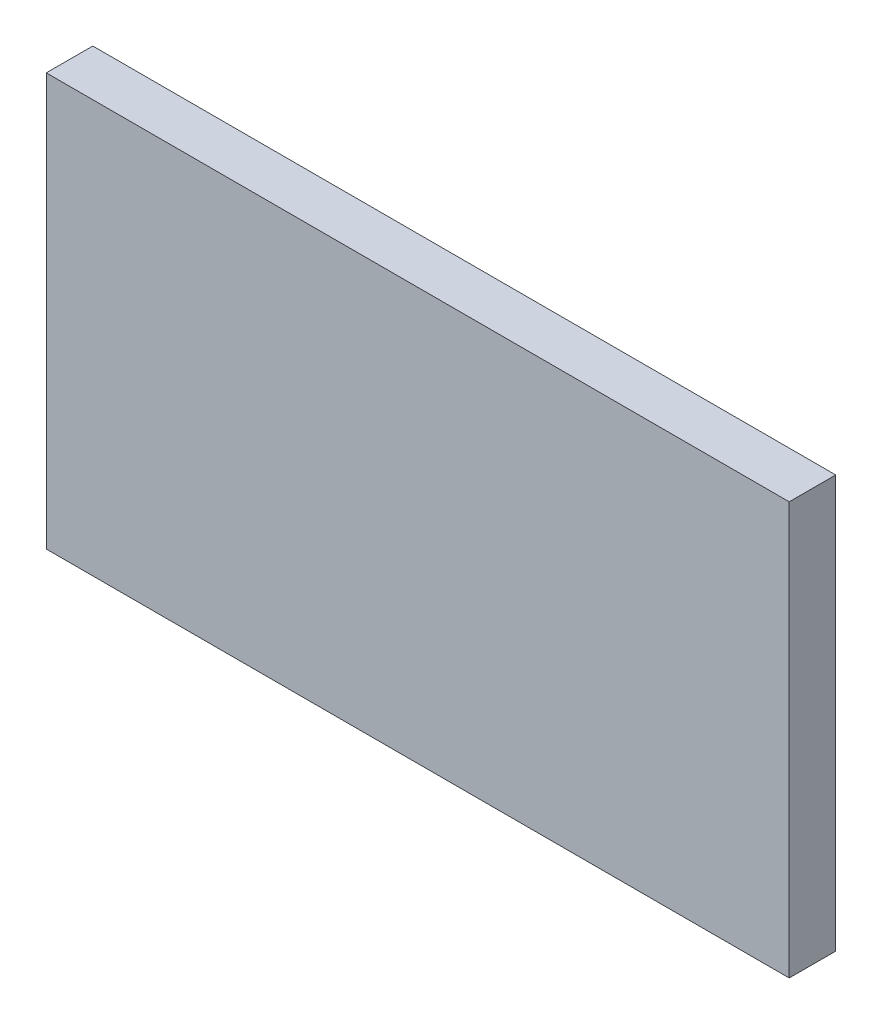
from build123d import *

# Parameters (mm, degrees)
ESQUISSE1_W        = 23.96
ESQUISSE1_H        = 13.3
BOSS_EXTRU_1_DEPTH = 1.5


with BuildPart() as part:
    # Esquisse1 → Boss.-Extru.1 (new body)
    with BuildSketch(Plane.XY):
        Rectangle(ESQUISSE1_W, ESQUISSE1_H)
    extrude(amount=BOSS_EXTRU_1_DEPTH)


solid = part.part
